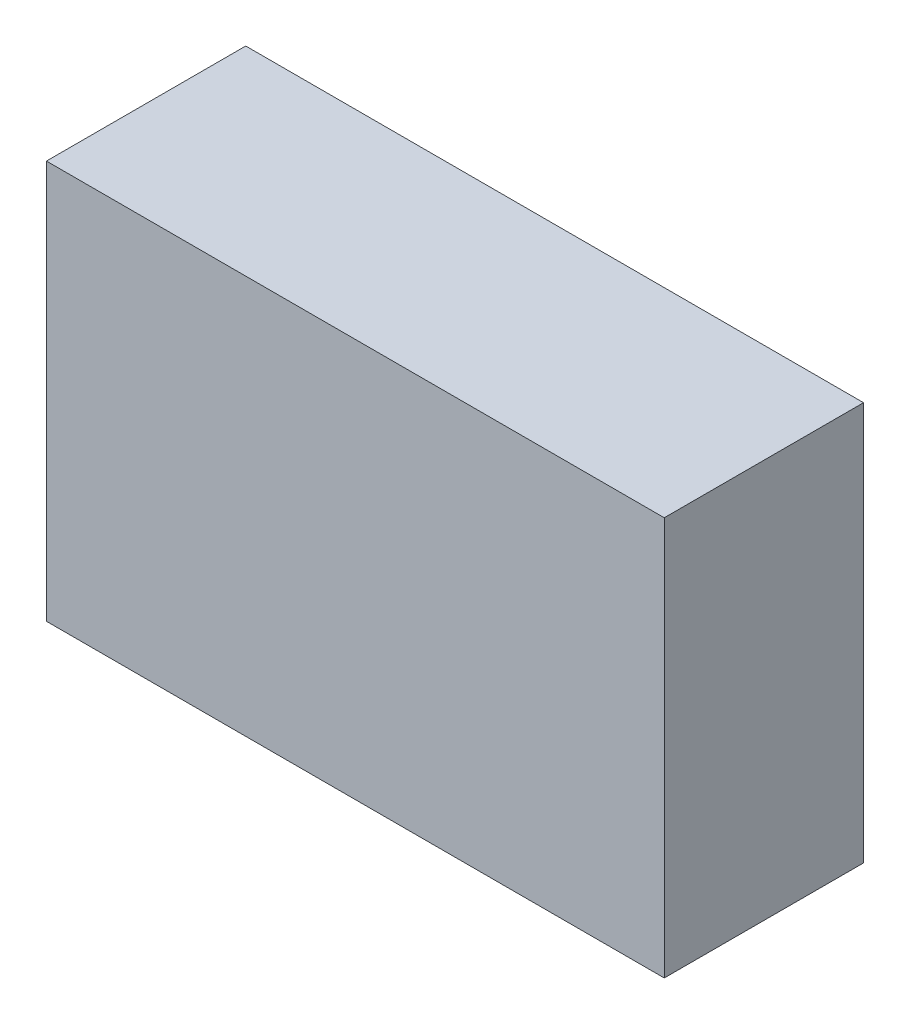
from build123d import *

# Parameters (mm, degrees)
SKETCH1_W           = 31
SKETCH1_H           = 20
BOSS_EXTRUDE1_DEPTH = 10


with BuildPart() as part:
    # Sketch1 → Boss-Extrude1 (new body)
    with BuildSketch(Plane.XY):
        with Locations((15.5, 10)):
            Rectangle(SKETCH1_W, SKETCH1_H)
    extrude(amount=BOSS_EXTRUDE1_DEPTH)


solid = part.part
